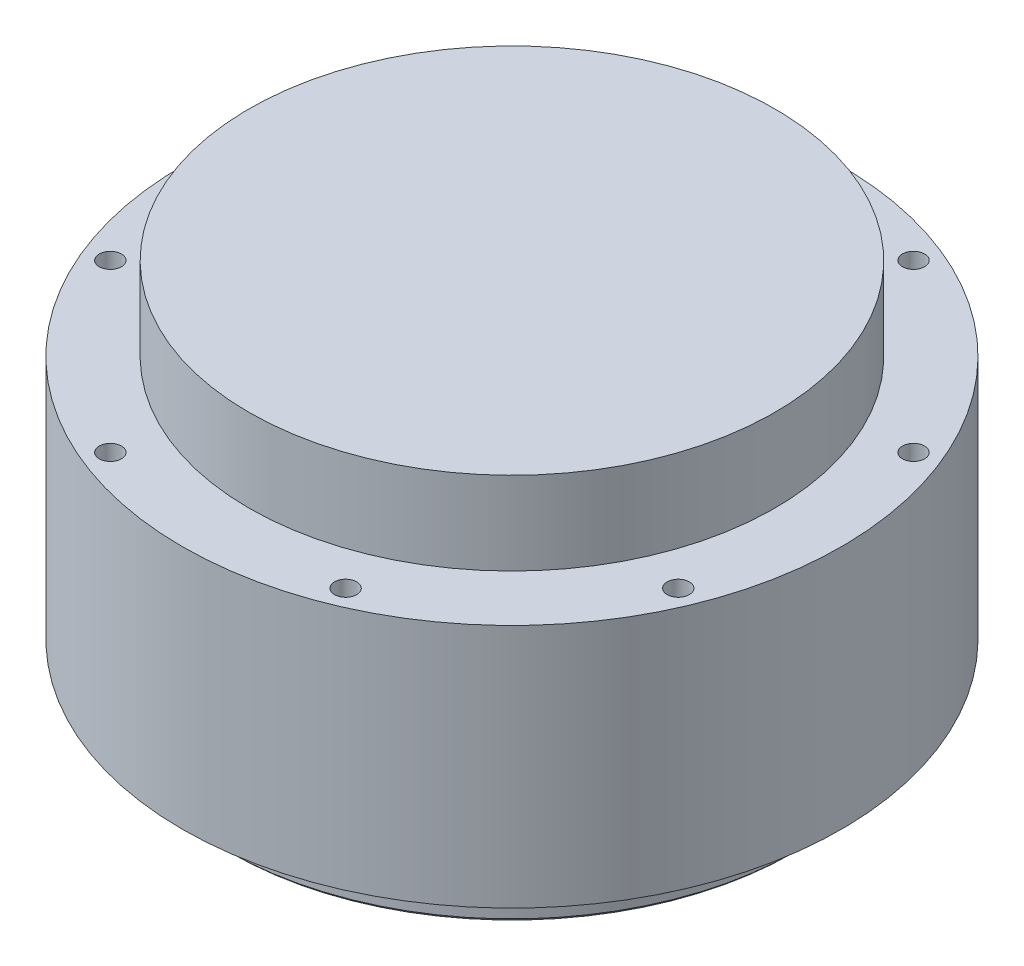
from build123d import *

# Parameters (mm, degrees)
SKETCH_1_R          = 44.5
SKETCH_1_R_2        = 1.5
EXTRUDE_1_DEPTH     = 33.05
SKETCH_2_R          = 35.5
EXTRUDE_2_DEPTH     = 11.2
SKETCH_3_R          = 38.5
EXTRUDE_3_DEPTH     = 6
CHAMFER_1_SIZE      = 0.5
SKETCH_5_R          = 17.5
CUT_EXTRUDE_1_DEPTH = 15


with BuildPart() as part:
    # Эскиз1 → Бобышка-Вытянуть1 (new body)
    with BuildSketch(Plane(origin=(0, 0, 0), x_dir=(1, 0, 0), z_dir=(0, 1, 0))):
        with Locations(Location((0, 0, 0), (0, 0, 270))):
            Circle(SKETCH_1_R)
        with Locations(Location((15.881362443, 38.341000599, 0), (0, 0, 270))):
            Circle(SKETCH_1_R_2, mode=Mode.SUBTRACT)
        with Locations(Location((38.341000599, 15.881362443, 0), (0, 0, 270))):
            Circle(SKETCH_1_R_2, mode=Mode.SUBTRACT)
        with Locations(Location((38.341000599, -15.881362443, 0), (0, 0, 270))):
            Circle(SKETCH_1_R_2, mode=Mode.SUBTRACT)
        with Locations(Location((15.881362443, -38.341000599, 0), (0, 0, 270))):
            Circle(SKETCH_1_R_2, mode=Mode.SUBTRACT)
        with Locations(Location((-15.881362443, -38.341000599, 0), (0, 0, 270))):
            Circle(SKETCH_1_R_2, mode=Mode.SUBTRACT)
        with Locations(Location((-38.341000599, -15.881362443, 0), (0, 0, 270))):
            Circle(SKETCH_1_R_2, mode=Mode.SUBTRACT)
        with Locations(Location((-38.341000599, 15.881362443, 0), (0, 0, 270))):
            Circle(SKETCH_1_R_2, mode=Mode.SUBTRACT)
        with Locations(Location((-15.881362443, 38.341000599, 0), (0, 0, 270))):
            Circle(SKETCH_1_R_2, mode=Mode.SUBTRACT)
    extrude(amount=EXTRUDE_1_DEPTH)

    # Эскиз2 → Бобышка-Вытянуть2 (add)
    with BuildSketch(Plane(origin=(0, 33.05, 0), x_dir=(1, 0, 0), z_dir=(0, 1, 0))):
        with Locations(Location((0, 0, 0), (0, 0, 270))):
            Circle(SKETCH_2_R)
    extrude(amount=EXTRUDE_2_DEPTH)

    # Эскиз3 → Бобышка-Вытянуть3 (add)
    with BuildSketch(Plane.XZ):
        with Locations(Location((0, 0, 0), (0, 0, 270))):
            Circle(SKETCH_3_R)
    extrude(amount=EXTRUDE_3_DEPTH)

    # Фаска1
    chamfer_1_edges = [part.edges().sort_by_distance(p)[0] for p in [
        (0, -6, 38.5),
    ]]
    chamfer(chamfer_1_edges, length=CHAMFER_1_SIZE)

    # Эскиз5 → Вырез-Вытянуть1 (cut)
    with BuildSketch(Plane.XZ.offset(6)):
        with Locations(Location((0, 0, 0), (0, 0, 270))):
            Circle(SKETCH_5_R)
    extrude(amount=-CUT_EXTRUDE_1_DEPTH, mode=Mode.SUBTRACT)


solid = part.part
